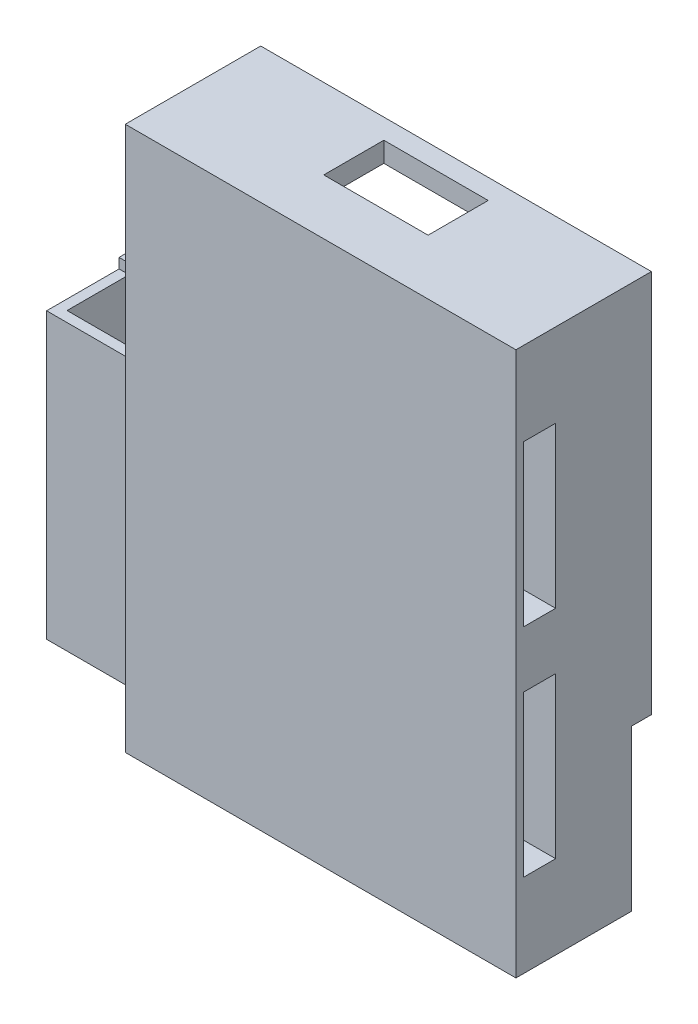
from build123d import *

# Parameters (mm, degrees)
BOSS_EXTRUDE1_DEPTH  = 83.0326
SKETCH6_W            = 61.8998
SKETCH6_H            = 21.463
BOSS_EXTRUDE3_DEPTH  = 3.175
SKETCH7_W            = 16.5354
SKETCH7_H            = 9.525
CUT_EXTRUDE2_DEPTH   = 91.420129415
SKETCH8_W            = 5.08
SKETCH8_H            = 25.4
CUT_EXTRUDE3_DEPTH   = 108.64212172
SKETCH15_W           = 27.7241
SKETCH15_H           = 45.085
BOSS_EXTRUDE5_DEPTH  = 3.175
SKETCH21_W           = 1.651
SKETCH21_H           = 45.085
BOSS_EXTRUDE10_DEPTH = 16.9926
SKETCH22_W           = 20.1676
SKETCH22_H           = 45.085
BOSS_EXTRUDE11_DEPTH = 1.5875
SKETCH23_W           = 29.3116
SKETCH23_H           = 45.085
BOSS_EXTRUDE12_DEPTH = 1.5875
SKETCH24_W           = 21.7551
SKETCH24_H           = 6.35
BOSS_EXTRUDE13_DEPTH = 1.5875
SKETCH25_W           = 61.8998
SKETCH25_H           = 25.4
CUT_EXTRUDE4_DEPTH   = 3.175


with BuildPart() as part:
    # Sketch1 → Boss-Extrude1 (new body)
    with BuildSketch(Plane(origin=(0, 0, 0), x_dir=(1, 0, 0), z_dir=(0, 1, 0))):
        Polygon((-30.9499, -3.477149156), (30.9499, -3.477149156), (30.9499, 17.985850844), (24.0411, 17.985850844), (24.0411, 14.810850844), (27.7749, 14.810850844), (27.7749, 5.285850844), (-27.7749, 5.285850844), (-27.7749, 14.810850844), (-24.0411, 14.810850844), (-24.0411, 17.985850844), (-30.9499, 17.985850844), align=None)
    extrude(amount=BOSS_EXTRUDE1_DEPTH)

    # Sketch6 → Boss-Extrude3 (add)
    with BuildSketch(Plane(origin=(0, 83.0326, 0), x_dir=(1, 0, 0), z_dir=(0, 1, 0))):
        with Locations((0, 7.254350844)):
            Rectangle(SKETCH6_W, SKETCH6_H)
    extrude(amount=BOSS_EXTRUDE3_DEPTH)

    # Sketch7 → Cut-Extrude2 (cut, through all)
    with BuildSketch(Plane.XZ.offset(-83.0326)):
        with Locations((0, -10.048350844)):
            Rectangle(SKETCH7_W, SKETCH7_H)
    extrude(amount=-CUT_EXTRUDE2_DEPTH, mode=Mode.SUBTRACT)

    # Sketch8 → Cut-Extrude3 (cut, through all)
    with BuildSketch(Plane.ZY.offset(30.9499)):
        with Locations((-0.274453158, 60.28364576)):
            Rectangle(SKETCH8_W, SKETCH8_H)
        with Locations((-0.274453158, 25.92395424)):
            Rectangle(SKETCH8_W, SKETCH8_H)
    extrude(amount=-CUT_EXTRUDE3_DEPTH, mode=Mode.SUBTRACT)

    # Sketch15 → Boss-Extrude5 (add)
    with BuildSketch(Plane.ZY.offset(30.9499)):
        with Locations((-19.676493716, 22.5425)):
            Rectangle(SKETCH15_W, SKETCH15_H)
    extrude(amount=BOSS_EXTRUDE5_DEPTH)

    # Sketch21 → Boss-Extrude10 (add)
    with BuildSketch(Plane.ZY.offset(34.1249)):
        with Locations((-6.639943716, 22.5425)):
            Rectangle(SKETCH21_W, SKETCH21_H)
    extrude(amount=BOSS_EXTRUDE10_DEPTH)

    # Sketch22 → Boss-Extrude11 (add)
    with BuildSketch(Plane(origin=(0, 0, -33.538543716), x_dir=(-1, 0, 0), z_dir=(0, 0, -1))):
        with Locations((41.0337, 22.5425)):
            Rectangle(SKETCH22_W, SKETCH22_H)
    extrude(amount=BOSS_EXTRUDE11_DEPTH)

    # Sketch23 → Boss-Extrude12 (add)
    with BuildSketch(Plane.ZY.offset(51.1175)):
        with Locations((-20.470243716, 22.5425)):
            Rectangle(SKETCH23_W, SKETCH23_H)
    extrude(amount=BOSS_EXTRUDE12_DEPTH)

    # Sketch24 → Boss-Extrude13 (add)
    with BuildSketch(Plane(origin=(0, 45.085, 0), x_dir=(1, 0, 0), z_dir=(0, 1, 0))):
        with Locations((-41.82745, 20.470243716)):
            Rectangle(SKETCH24_W, SKETCH24_H)
    extrude(amount=BOSS_EXTRUDE13_DEPTH)

    # Sketch25 → Cut-Extrude4 (cut)
    with BuildSketch(Plane(origin=(0, 0, -17.985850844), x_dir=(-1, 0, 0), z_dir=(0, 0, -1))):
        with Locations((0, 12.7)):
            Rectangle(SKETCH25_W, SKETCH25_H)
    extrude(amount=-CUT_EXTRUDE4_DEPTH, mode=Mode.SUBTRACT)


solid = part.part
